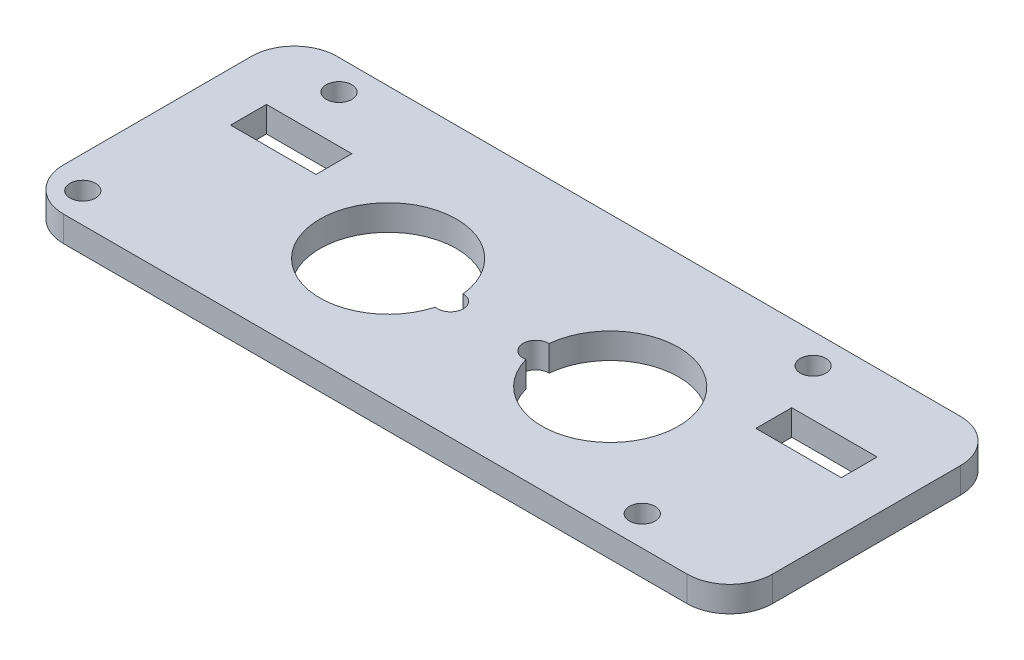
from build123d import *

# Parameters (mm, degrees)
SKETCH1_W           = 95
SKETCH1_H           = 35
BOSS_EXTRUDE1_DEPTH = 3
CUT_EXTRUDE1_REACH  = 52.71
SKETCH3_R           = 8
CUT_EXTRUDE2_REACH  = 52.71
SKETCH4_R           = 1.5
SKETCH5_W           = 95
SKETCH5_H           = 4
BOSS_EXTRUDE2_DEPTH = 3
CUT_EXTRUDE3_REACH  = 54.225
SKETCH6_W           = 10
SKETCH6_H           = 4.2
CUT_EXTRUDE4_REACH  = 54.225
SKETCH7_R           = 1.5
CUT_EXTRUDE5_REACH  = 54.225
SKETCH8_W           = 105.539235452
SKETCH8_H           = 51.644684014
SKETCH8_W_2         = 83
SKETCH8_H_2         = 32
FILLET1_R           = 5


with BuildPart() as part:
    # Sketch1 → Boss-Extrude1 (new body)
    with BuildSketch(Plane(origin=(0, 0, 0), x_dir=(1, 0, 0), z_dir=(0, 1, 0))):
        Rectangle(SKETCH1_W, SKETCH1_H)
    extrude(amount=BOSS_EXTRUDE1_DEPTH)

    # Sketch3 → Cut-Extrude1 (cut, up to next)
    with BuildSketch(Plane.XZ, mode=Mode.PRIVATE) as cut_extrude1_sk1:
        with Locations(Location((-13, 1.5, 0), (0, 0, 270))):
            Circle(SKETCH3_R)
    cut_extrude1_tool1 = extrude(cut_extrude1_sk1.sketch, amount=-CUT_EXTRUDE1_REACH, mode=Mode.PRIVATE) & part.part
    # Sketch3 → Cut-Extrude1 (cut, up to next)
    with BuildSketch(Plane.XZ, mode=Mode.PRIVATE) as cut_extrude1_sk2:
        with Locations(Location((13, 1.5, 0), (0, 0, 270))):
            Circle(SKETCH3_R)
    cut_extrude1_tool2 = extrude(cut_extrude1_sk2.sketch, amount=-CUT_EXTRUDE1_REACH, mode=Mode.PRIVATE) & part.part
    add(cut_extrude1_tool1.solids().sort_by_distance((-13, 0, 1.5))[0], mode=Mode.SUBTRACT)
    add(cut_extrude1_tool2.solids().sort_by_distance((13, 0, 1.5))[0], mode=Mode.SUBTRACT)

    # Sketch4 → Cut-Extrude2 (cut, up to next)
    with BuildSketch(Plane(origin=(0, 0, 0), x_dir=(1, 0, 0), z_dir=(0, 1, 0)), mode=Mode.PRIVATE) as cut_extrude2_sk1:
        with Locations(Location((-37.75, -12.5, 0), (0, 0, 90))):
            Circle(SKETCH4_R)
    cut_extrude2_tool1 = extrude(cut_extrude2_sk1.sketch, amount=CUT_EXTRUDE2_REACH, mode=Mode.PRIVATE) & part.part
    # Sketch4 → Cut-Extrude2 (cut, up to next)
    with BuildSketch(Plane(origin=(0, 0, 0), x_dir=(1, 0, 0), z_dir=(0, 1, 0)), mode=Mode.PRIVATE) as cut_extrude2_sk2:
        with Locations(Location((27.75, -12.5, 0), (0, 0, 90))):
            Circle(SKETCH4_R)
    cut_extrude2_tool2 = extrude(cut_extrude2_sk2.sketch, amount=CUT_EXTRUDE2_REACH, mode=Mode.PRIVATE) & part.part
    # Sketch4 → Cut-Extrude2 (cut, up to next)
    with BuildSketch(Plane(origin=(0, 0, 0), x_dir=(1, 0, 0), z_dir=(0, 1, 0)), mode=Mode.PRIVATE) as cut_extrude2_sk3:
        with Locations(Location((22.75, 12.5, 0), (0, 0, 90))):
            Circle(SKETCH4_R)
    cut_extrude2_tool3 = extrude(cut_extrude2_sk3.sketch, amount=CUT_EXTRUDE2_REACH, mode=Mode.PRIVATE) & part.part
    # Sketch4 → Cut-Extrude2 (cut, up to next)
    with BuildSketch(Plane(origin=(0, 0, 0), x_dir=(1, 0, 0), z_dir=(0, 1, 0)), mode=Mode.PRIVATE) as cut_extrude2_sk4:
        with Locations(Location((-32.75, 12.5, 0), (0, 0, 90))):
            Circle(SKETCH4_R)
    cut_extrude2_tool4 = extrude(cut_extrude2_sk4.sketch, amount=CUT_EXTRUDE2_REACH, mode=Mode.PRIVATE) & part.part
    add(cut_extrude2_tool1.solids().sort_by_distance((-37.75, 0, 12.5))[0], mode=Mode.SUBTRACT)
    add(cut_extrude2_tool2.solids().sort_by_distance((27.75, 0, 12.5))[0], mode=Mode.SUBTRACT)
    add(cut_extrude2_tool3.solids().sort_by_distance((22.75, 0, -12.5))[0], mode=Mode.SUBTRACT)
    add(cut_extrude2_tool4.solids().sort_by_distance((-32.75, 0, -12.5))[0], mode=Mode.SUBTRACT)

    # Sketch5 → Boss-Extrude2 (add)
    with BuildSketch(Plane(origin=(0, 0, 0), x_dir=(1, 0, 0), z_dir=(0, 1, 0))):
        with Locations((0, -19.5)):
            Rectangle(SKETCH5_W, SKETCH5_H)
        with Locations((0, 19.5)):
            Rectangle(SKETCH5_W, SKETCH5_H)
    extrude(amount=BOSS_EXTRUDE2_DEPTH)

    # Sketch6 → Cut-Extrude3 (cut, up to next)
    with BuildSketch(Plane(origin=(0, 0, 0), x_dir=(1, 0, 0), z_dir=(0, 1, 0)), mode=Mode.PRIVATE) as cut_extrude3_sk1:
        with Locations((-30.75, 4.9)):
            Rectangle(SKETCH6_W, SKETCH6_H)
    cut_extrude3_tool1 = extrude(cut_extrude3_sk1.sketch, amount=CUT_EXTRUDE3_REACH, mode=Mode.PRIVATE) & part.part
    # Sketch6 → Cut-Extrude3 (cut, up to next)
    with BuildSketch(Plane(origin=(0, 0, 0), x_dir=(1, 0, 0), z_dir=(0, 1, 0)), mode=Mode.PRIVATE) as cut_extrude3_sk2:
        with Locations((30.75, 4.9)):
            Rectangle(SKETCH6_W, SKETCH6_H)
    cut_extrude3_tool2 = extrude(cut_extrude3_sk2.sketch, amount=CUT_EXTRUDE3_REACH, mode=Mode.PRIVATE) & part.part
    add(cut_extrude3_tool1.solids().sort_by_distance((-30.75, 0, -4.9))[0], mode=Mode.SUBTRACT)
    add(cut_extrude3_tool2.solids().sort_by_distance((30.75, 0, -4.9))[0], mode=Mode.SUBTRACT)

    # Sketch7 → Cut-Extrude4 (cut, up to next)
    with BuildSketch(Plane.XZ, mode=Mode.PRIVATE) as cut_extrude4_sk1:
        with Locations((-5, 2.201101087)):
            Circle(SKETCH7_R)
    cut_extrude4_tool1 = extrude(cut_extrude4_sk1.sketch, amount=-CUT_EXTRUDE4_REACH, mode=Mode.PRIVATE) & part.part
    # Sketch7 → Cut-Extrude4 (cut, up to next)
    with BuildSketch(Plane.XZ, mode=Mode.PRIVATE) as cut_extrude4_sk2:
        with Locations((5, 2.201101087)):
            Circle(SKETCH7_R)
    cut_extrude4_tool2 = extrude(cut_extrude4_sk2.sketch, amount=-CUT_EXTRUDE4_REACH, mode=Mode.PRIVATE) & part.part
    add(cut_extrude4_tool1.solids().sort_by_distance((-5, 0, 2.201101))[0], mode=Mode.SUBTRACT)
    add(cut_extrude4_tool2.solids().sort_by_distance((5, 0, 2.201101))[0], mode=Mode.SUBTRACT)

    # Sketch8 → Cut-Extrude5 (cut, up to next)
    with BuildSketch(Plane(origin=(0, 0, 0), x_dir=(1, 0, 0), z_dir=(0, 1, 0)), mode=Mode.PRIVATE) as cut_extrude5_sk1:
        Rectangle(SKETCH8_W, SKETCH8_H)
        Rectangle(SKETCH8_W_2, SKETCH8_H_2, mode=Mode.SUBTRACT)
    cut_extrude5_tool1 = extrude(cut_extrude5_sk1.sketch, amount=CUT_EXTRUDE5_REACH, mode=Mode.PRIVATE) & part.part
    add(cut_extrude5_tool1.solids().sort_by_distance((0, 0, -24.647365))[0], mode=Mode.SUBTRACT)

    # Fillet1
    fillet1_edges = [part.edges().sort_by_distance(p)[0] for p in [
        (41.5, 1.5, -16),
        (-41.5, 1.5, -16),
        (-41.5, 1.5, 16),
        (41.5, 1.5, 16),
    ]]
    fillet(fillet1_edges, radius=FILLET1_R)


solid = part.part
